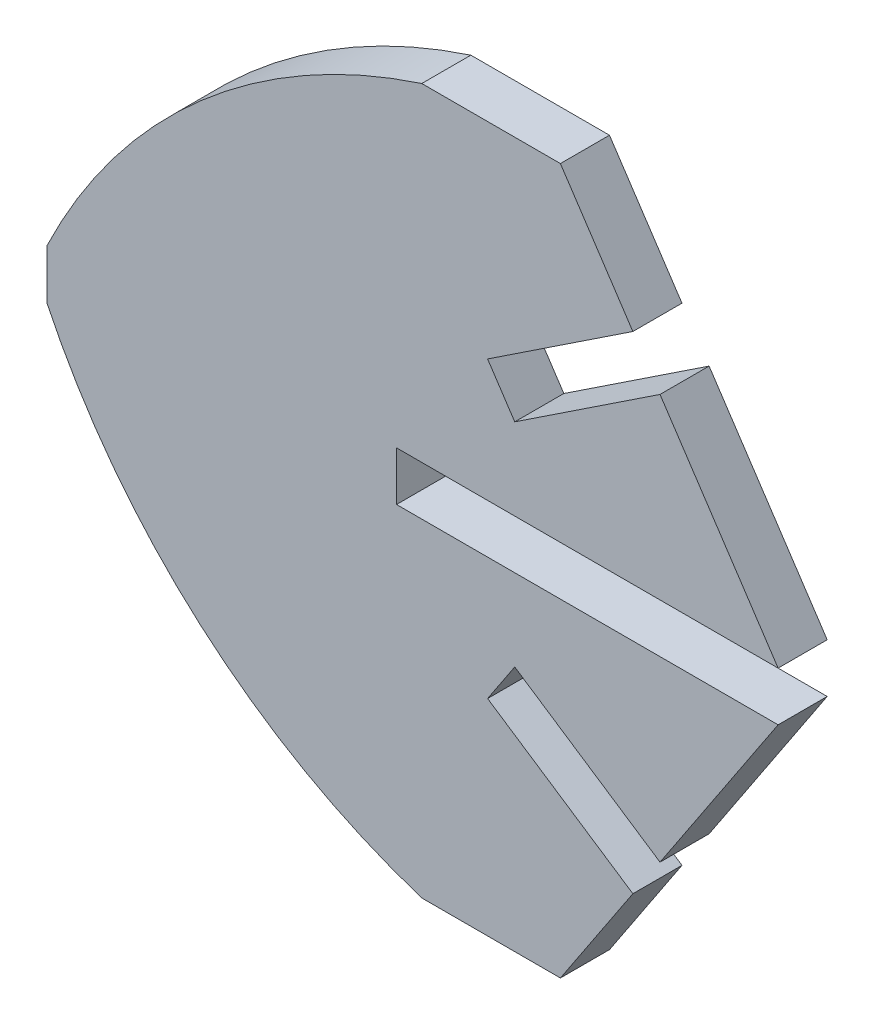
from build123d import *

# Parameters (mm, degrees)
BOSS_EXTRUDE1_DEPTH = 1.524


with BuildPart() as part:
    # Sketch1 → Boss-Extrude1 (new body)
    with BuildSketch(Plane.XY):
        with BuildLine():
            Line((90.459222019, -1.524), (102.307099067, -1.524))
            Line((102.307099067, -1.524), (98.640274248, -7.050584921))
            Line((98.640274248, -7.050584921), (94.129691871, -4.057865973))
            Line((94.129691871, -4.057865973), (93.28712507, -5.327770374))
            Line((93.28712507, -5.327770374), (97.797707447, -8.320489321))
            Line((97.797707447, -8.320489321), (95.547284868, -11.712293431))
            Line((95.547284868, -11.712293431), (91.242630209, -11.712293431))
            ThreePointArc((91.242630209, -11.712293431), (84.374873322, -7.81416263), (79.600424402, -1.524))
            Line((79.600424402, -1.524), (79.600424402, 0))
            ThreePointArc((79.600424402, 0), (84.374873322, 6.29016263), (91.242630209, 10.188293431))
            Line((91.242630209, 10.188293431), (95.547284868, 10.188293431))
            Line((95.547284868, 10.188293431), (97.797707447, 6.796489321))
            Line((97.797707447, 6.796489321), (93.28712507, 3.803770374))
            Line((93.28712507, 3.803770374), (94.129691871, 2.533865973))
            Line((94.129691871, 2.533865973), (98.640274248, 5.526584921))
            Line((98.640274248, 5.526584921), (102.307099067, 0))
            Line((102.307099067, 0), (90.459222019, 0))
            Line((90.459222019, 0), (90.459222019, -1.524))
        make_face()
    extrude(amount=BOSS_EXTRUDE1_DEPTH)


solid = part.part
